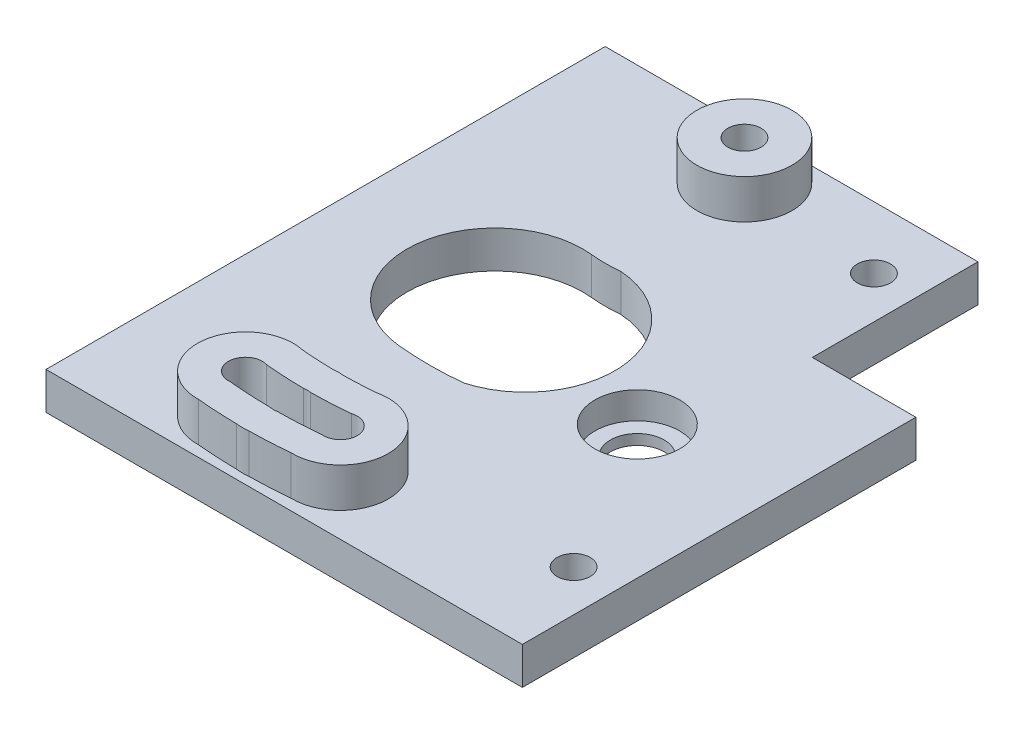
from build123d import *

# Parameters (mm, degrees)
SKETCH_1_W          = 46
SKETCH_1_H          = 54
EXTRUDE_1_DEPTH     = 3.6
SKETCH_2_R          = 1.6
SKETCH_2_R_2        = 1.634420344
SKETCH_2_R_3        = 8.5
SKETCH_2_R_4        = 4.1
CUT_EXTRUDE_1_DEPTH = 3.6
SKETCH_4_R          = 4.1
SKETCH_4_R_2        = 2.6
EXTRUDE_2_DEPTH     = 1
SKETCH_5_W          = 10
SKETCH_5_H          = 16
CUT_EXTRUDE_2_DEPTH = 4
CUT_EXTRUDE_3_DEPTH = 10
SKETCH_7_R          = 4.6
SKETCH_7_R_2        = 1.6
EXTRUDE_3_DEPTH     = 3.8
SKETCH_10_R         = 1.6
CUT_EXTRUDE_6_DEPTH = 72.038299529
SKETCH_11_R         = 1.6
CUT_EXTRUDE_7_DEPTH = 72.038299529


with BuildPart() as part:
    # 草图1 → 凸台-拉伸1 (new body)
    with BuildSketch(Plane(origin=(0, 0, 0), x_dir=(1, 0, 0), z_dir=(0, 1, 0))):
        with Locations((23, 27)):
            Rectangle(SKETCH_1_W, SKETCH_1_H)
    extrude(amount=EXTRUDE_1_DEPTH)

    # 草图2 → 切除-拉伸1 (cut)
    with BuildSketch(Plane(origin=(0, 0, 0), x_dir=(-1, 0, 0), z_dir=(0, -1, 0))):
        with Locations(Location((-18.15, 49.3, 0), (0, 0, 90))):
            Circle(SKETCH_2_R)
        with Locations(Location((-18.15, 5.45, 0), (0, 0, 90))):
            Circle(SKETCH_2_R_2)
        with Locations(Location((-18.15, 27.375, 0), (0, 0, 90))):
            Circle(SKETCH_2_R_3)
        with Locations(Location((-33.15, 23.95, 0), (0, 0, 90))):
            Circle(SKETCH_2_R_4)
    extrude(amount=-CUT_EXTRUDE_1_DEPTH, mode=Mode.SUBTRACT)

    # 草图4 → 凸台-拉伸2 (add)
    with BuildSketch(Plane(origin=(0, 0, 0), x_dir=(-1, 0, 0), z_dir=(0, -1, 0))):
        with Locations(Location((-33.15, 23.95, 0), (0, 0, 90))):
            Circle(SKETCH_4_R)
        with Locations(Location((-33.15, 23.95, 0), (0, 0, 90))):
            Circle(SKETCH_4_R_2, mode=Mode.SUBTRACT)
    extrude(amount=-EXTRUDE_2_DEPTH)

    # 草图5 → 切除-拉伸2 (cut)
    with BuildSketch(Plane(origin=(0, 3.6, 0), x_dir=(1, 0, 0), z_dir=(0, 1, 0))):
        with Locations((41, 46)):
            Rectangle(SKETCH_5_W, SKETCH_5_H)
    extrude(amount=-CUT_EXTRUDE_2_DEPTH, mode=Mode.SUBTRACT)

    # 草图6 → 切除-拉伸3 (cut)
    with BuildSketch(Plane(origin=(0, 0, 0), x_dir=(-1, 0, 0), z_dir=(0, -1, 0))):
        with BuildLine():
            ThreePointArc((-22.56285512, 4.064734889), (-18.15, 3.85), (-13.73714488, 4.064734889))
            ThreePointArc((-13.73714488, 4.064734889), (-11.94032174, 5.854871857), (-14.05952591, 7.248477772))
            ThreePointArc((-14.05952591, 7.248477772), (-18.15, 7.05), (-22.24047409, 7.248477772))
            ThreePointArc((-22.24047409, 7.248477772), (-24.35967826, 5.854871857), (-22.56285512, 4.064734889))
        make_face()
        with BuildLine():
            ThreePointArc((-21.330278495, 19.041671333), (-18.15, 18.875), (-14.969721505, 19.041671333))
            ThreePointArc((-14.969721505, 19.041671333), (-7.404777332, 28.383599382), (-16.746705381, 35.948543555))
            ThreePointArc((-16.746705381, 35.948543555), (-18.15, 35.875), (-19.553294619, 35.948543555))
            ThreePointArc((-19.553294619, 35.948543555), (-27.538099682, 28.240960008), (-21.330278495, 19.041671333))
        make_face()
    extrude(amount=-CUT_EXTRUDE_3_DEPTH, mode=Mode.SUBTRACT)

    # 草图7 → 凸台-拉伸3 (add)
    # profile 1 of 2: a face of its own
    with BuildSketch(Plane(origin=(0, 3.6, 0), x_dir=(1, 0, 0), z_dir=(0, 1, 0))):
        with Locations(Location((18.15, 49.3, 0), (0, 0, 90))):
            Circle(SKETCH_7_R)
        with Locations(Location((18.15, 49.3, 0), (0, 0, 90))):
            Circle(SKETCH_7_R_2, mode=Mode.SUBTRACT)
    # profile 2 of 2: a face of its own
    with BuildSketch(Plane(origin=(0, 3.6, 0), x_dir=(1, 0, 0), z_dir=(0, 1, 0))):
        with BuildLine():
            ThreePointArc((18.683380864, 10.053624309), (20.204186283, 10.103790761), (21.721904392, 10.21286658))
            ThreePointArc((21.721904392, 10.21286658), (27.345628596, 6.144963348), (22.624665084, 1.05707438))
            ThreePointArc((22.624665084, 1.05707438), (20.68567708, 0.916399041), (18.742606478, 0.853624309))
            ThreePointArc((18.742606478, 0.853624309), (18.15, 0.815579656), (17.557393522, 0.853624309))
            ThreePointArc((17.557393522, 0.853624309), (15.61432292, 0.916399041), (13.675334916, 1.05707438))
            ThreePointArc((13.675334916, 1.05707438), (8.954371404, 6.144963348), (14.578095608, 10.21286658))
            ThreePointArc((14.578095608, 10.21286658), (16.095813717, 10.103790761), (17.616619136, 10.053624309))
            ThreePointArc((17.616619136, 10.053624309), (18.15, 10.084420344), (18.683380864, 10.053624309))
        make_face()
        with BuildLine():
            ThreePointArc((18.477514951, 7.05126944), (20.361194151, 7.107902157), (22.24047409, 7.248477772))
            ThreePointArc((22.24047409, 7.248477772), (24.35967826, 5.854871857), (22.56285512, 4.064734889))
            ThreePointArc((22.56285512, 4.064734889), (20.528669211, 3.912287645), (18.489691709, 3.85126944))
            ThreePointArc((18.489691709, 3.85126944), (18.15, 3.815579656), (17.810308291, 3.85126944))
            ThreePointArc((17.810308291, 3.85126944), (15.771330789, 3.912287645), (13.73714488, 4.064734889))
            ThreePointArc((13.73714488, 4.064734889), (11.94032174, 5.854871857), (14.05952591, 7.248477772))
            ThreePointArc((14.05952591, 7.248477772), (15.938805849, 7.107902157), (17.822485049, 7.05126944))
            ThreePointArc((17.822485049, 7.05126944), (18.15, 7.084420344), (18.477514951, 7.05126944))
        make_face(mode=Mode.SUBTRACT)
    extrude(amount=EXTRUDE_3_DEPTH)

    # 草图10 → 切除-拉伸6 (cut, through all)
    with BuildSketch(Plane(origin=(0, 3.6, 0), x_dir=(1, 0, 0), z_dir=(0, 1, 0))):
        with Locations(Location((42, 8.95, 0), (0, 0, 270))):
            Circle(SKETCH_10_R)
    extrude(amount=-CUT_EXTRUDE_6_DEPTH, mode=Mode.SUBTRACT)

    # 草图11 → 切除-拉伸7 (cut, through all)
    with BuildSketch(Plane(origin=(0, 3.6, 0), x_dir=(1, 0, 0), z_dir=(0, 1, 0))):
        with Locations(Location((31.95, 48, 0), (0, 0, 270))):
            Circle(SKETCH_11_R)
    extrude(amount=-CUT_EXTRUDE_7_DEPTH, mode=Mode.SUBTRACT)


solid = part.part
